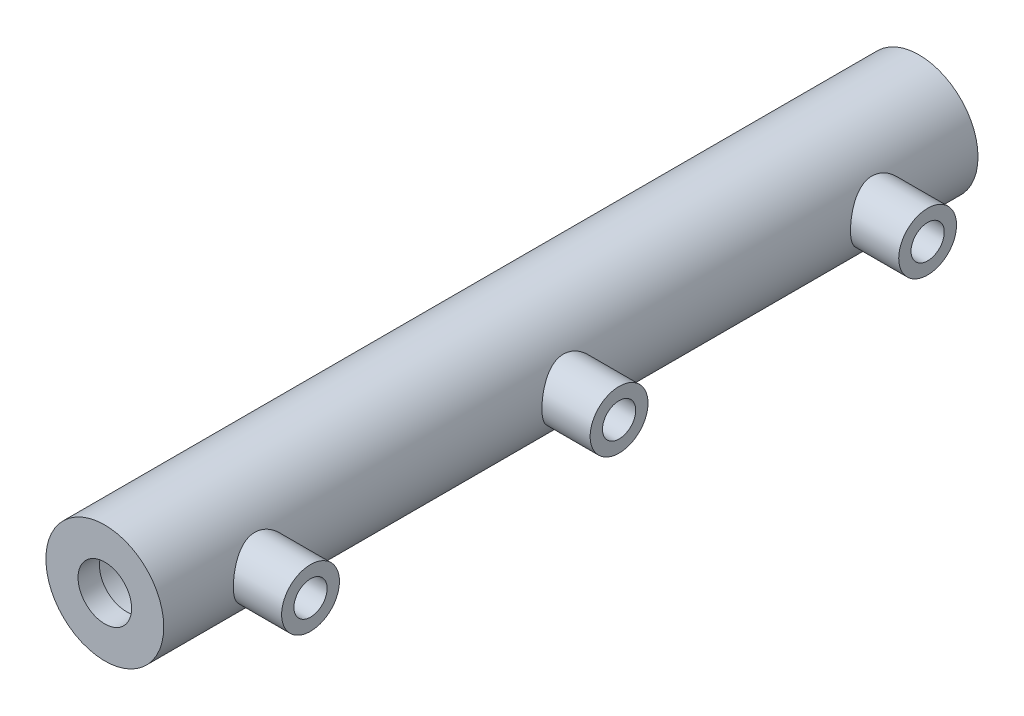
from build123d import *

# Parameters (mm, degrees)
SKETCH_3_R              = 27.5
SKETCH_3_R_2            = 20
EXTRUDE_1_DEPTH         = 190
SKETCH_4_R              = 27.5
SKETCH_4_R_2            = 12.5
EXTRUDE_2_DEPTH         = 10
EXTRUDE_START           = -10
SKETCH_5_R              = 27.5
SKETCH_5_R_2            = 12.5
EXTRUDE_3_DEPTH         = 10
EXTRUDE_4_REACH         = 209.033
EXTRUDE_4_END_RADIUS    = 27.5
SKETCH_6_R              = 13.5
HOLE_WIZARD_M18_1_D     = 15.5
HOLE_WIZARD_M18_1_DEPTH = 48.5
HOLE_WIZARD_M18_1_TIP   = 4.656669797


with BuildPart() as part:
    # 草图3 → 凸台-拉伸1 (new, symmetric)
    with BuildSketch(Plane.XY):
        Circle(SKETCH_3_R)
        Circle(SKETCH_3_R_2, mode=Mode.SUBTRACT)
    extrude(amount=EXTRUDE_1_DEPTH, both=True)

    # 草图4 → 凸台-拉伸2 (add)
    with BuildSketch(Plane.XY.offset(190)):
        Circle(SKETCH_4_R)
        Circle(SKETCH_4_R_2, mode=Mode.SUBTRACT)
    extrude(amount=-EXTRUDE_2_DEPTH)

    # 草图5 → 凸台-拉伸3 (add)
    with BuildSketch(Plane(origin=(0, 0, -190), x_dir=(-1, 0, 0), z_dir=(0, 0, -1)).offset(EXTRUDE_START)):
        with Locations(Location((0, 0, 0), (0, 0, 180))):
            Circle(SKETCH_5_R)
        with Locations(Location((0, 0, 0), (0, 0, 180))):
            Circle(SKETCH_5_R_2, mode=Mode.SUBTRACT)
    extrude(amount=EXTRUDE_3_DEPTH)

    # 凸台-拉伸4: up to this cylinder (the profile starts outside it)
    extrude_4_end = Plane(origin=(0, 0, 0), z_dir=(0, 0, -1)) * Cylinder(EXTRUDE_4_END_RADIUS, 762.066, mode=Mode.PRIVATE)
    # 草图6 → 凸台-拉伸4 (add, up to the surface)
    with BuildSketch(Plane(origin=(50, 0, 0), x_dir=(0, 0, -1), z_dir=(1, 0, 0)), mode=Mode.PRIVATE) as extrude_4_sk1:
        Circle(SKETCH_6_R)
    extrude_4_tool1 = extrude(extrude_4_sk1.sketch, amount=-EXTRUDE_4_REACH, mode=Mode.PRIVATE) - extrude_4_end
    add(extrude_4_tool1.solids().sort_by_distance((50, 0, 0))[0])
    # 草图6 → 凸台-拉伸4 (add, up to the surface)
    with BuildSketch(Plane(origin=(50, 0, 0), x_dir=(0, 0, -1), z_dir=(1, 0, 0)), mode=Mode.PRIVATE) as extrude_4_sk2:
        with Locations((-144, 0)):
            Circle(SKETCH_6_R)
    extrude_4_tool2 = extrude(extrude_4_sk2.sketch, amount=-EXTRUDE_4_REACH, mode=Mode.PRIVATE) - extrude_4_end
    add(extrude_4_tool2.solids().sort_by_distance((50, 0, 144))[0])
    # 草图6 → 凸台-拉伸4 (add, up to the surface)
    with BuildSketch(Plane(origin=(50, 0, 0), x_dir=(0, 0, -1), z_dir=(1, 0, 0)), mode=Mode.PRIVATE) as extrude_4_sk3:
        with Locations(Location((144, 0, 0), (0, 0, 180))):
            Circle(SKETCH_6_R)
    extrude_4_tool3 = extrude(extrude_4_sk3.sketch, amount=-EXTRUDE_4_REACH, mode=Mode.PRIVATE) - extrude_4_end
    add(extrude_4_tool3.solids().sort_by_distance((50, 0, -144))[0])

    # M18 螺纹孔1
    with Locations(Plane(origin=(50, 0, 144), x_dir=(0, 0, 1), z_dir=(1, 0, 0))):
        with Locations((0, 0), (-144, 0), (-288, 0)):
            Hole(HOLE_WIZARD_M18_1_D / 2, depth=HOLE_WIZARD_M18_1_DEPTH)
            with Locations((0, 0, -(HOLE_WIZARD_M18_1_DEPTH + HOLE_WIZARD_M18_1_TIP / 2))):  # 118° drill point
                Cone(0, HOLE_WIZARD_M18_1_D / 2, HOLE_WIZARD_M18_1_TIP, mode=Mode.SUBTRACT)


solid = part.part
